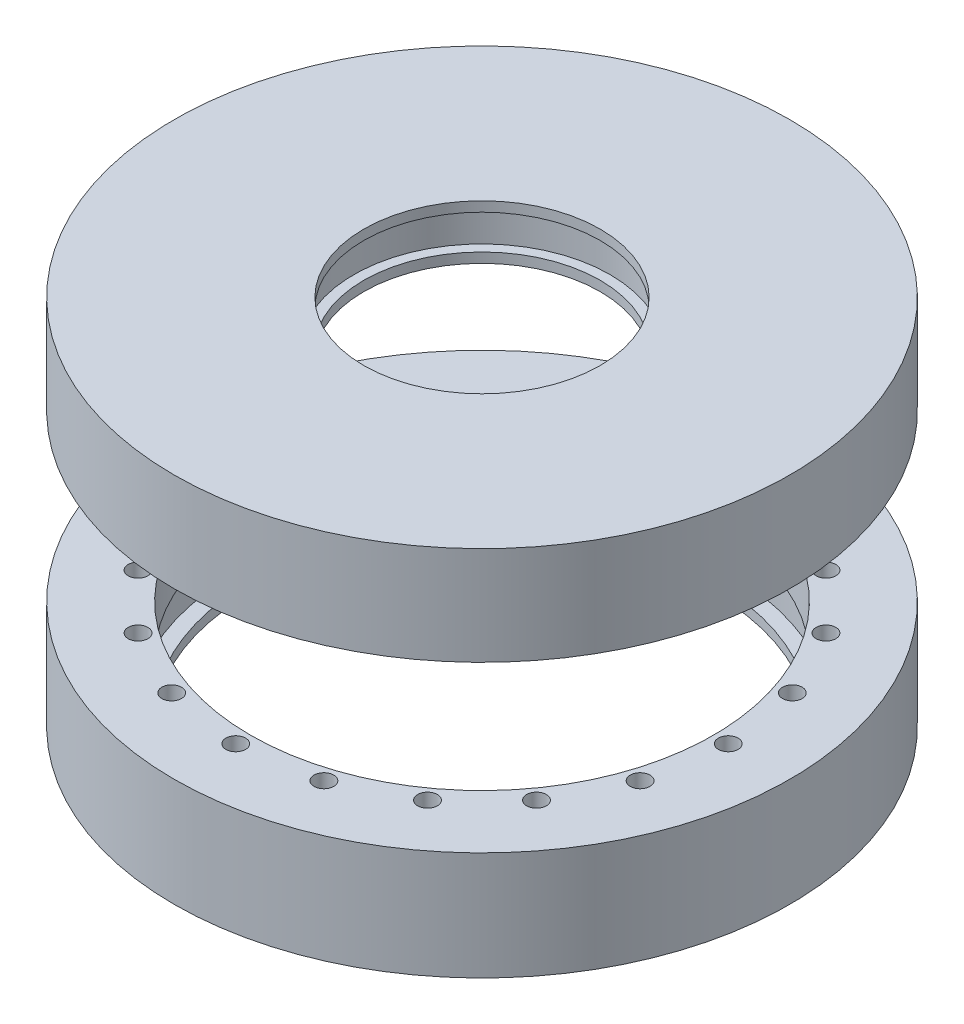
from build123d import *

# Parameters (mm, degrees)
CUT_EXTRUDE5_START = -2.5
SKETCH3_R          = 2
CUT_EXTRUDE5_DEPTH = 50
CUT_EXTRUDE6_START = 33.5
SKETCH5_R          = 62.5
CUT_EXTRUDE6_DEPTH = 33.5


with BuildPart() as part:
    # Sketch2 → Revolve1 (revolve)
    with BuildSketch(Plane(origin=(0, 0, 0), x_dir=(0, 0, -1), z_dir=(1, 0, 0))):
        Polygon((47, -37.75), (62.5, -37.75), (62.5, 37.75), (24, 37.75), (24, 35.75), (26, 35.75), (26, 28.75), (24, 28.75), (24, 26.75), (42.5, 26.75), (42.5, 17.75), (53, 17.75), (53, -15.75), (47, -15.75), (47, -25.75), (50, -25.75), (50, -35.75), (47, -35.75), align=None)
    revolve(axis=Axis((0, -15.437269333, 0), (0, 1, 0)))

    # Sketch3 → Cut-Extrude5 (cut)
    with BuildSketch(Plane.XZ.offset(25.75).offset(CUT_EXTRUDE5_START)):
        with Locations(Location((-47.552825815, 15.450849719, 0), (0, 0, 270))):
            Circle(SKETCH3_R)
        with Locations(Location((-40.450849719, 29.389262615, 0), (0, 0, 270))):
            Circle(SKETCH3_R)
        with Locations(Location((-29.389262615, 40.450849719, 0), (0, 0, 270))):
            Circle(SKETCH3_R)
        with Locations(Location((-15.450849719, 47.552825815, 0), (0, 0, 270))):
            Circle(SKETCH3_R)
        with Locations(Location((0, 50, 0), (0, 0, 270))):
            Circle(SKETCH3_R)
        with Locations(Location((15.450849719, 47.552825815, 0), (0, 0, 270))):
            Circle(SKETCH3_R)
        with Locations(Location((29.389262615, 40.450849719, 0), (0, 0, 270))):
            Circle(SKETCH3_R)
        with Locations(Location((40.450849719, 29.389262615, 0), (0, 0, 270))):
            Circle(SKETCH3_R)
        with Locations(Location((47.552825815, 15.450849719, 0), (0, 0, 270))):
            Circle(SKETCH3_R)
        with Locations(Location((50, 0, 0), (0, 0, 270))):
            Circle(SKETCH3_R)
        with Locations(Location((47.552825815, -15.450849719, 0), (0, 0, 270))):
            Circle(SKETCH3_R)
        with Locations(Location((40.450849719, -29.389262615, 0), (0, 0, 270))):
            Circle(SKETCH3_R)
        with Locations(Location((29.389262615, -40.450849719, 0), (0, 0, 270))):
            Circle(SKETCH3_R)
        with Locations(Location((15.450849719, -47.552825815, 0), (0, 0, 270))):
            Circle(SKETCH3_R)
        with Locations(Location((0, -50, 0), (0, 0, 270))):
            Circle(SKETCH3_R)
        with Locations(Location((-15.450849719, -47.552825815, 0), (0, 0, 270))):
            Circle(SKETCH3_R)
        with Locations(Location((-29.389262615, -40.450849719, 0), (0, 0, 270))):
            Circle(SKETCH3_R)
        with Locations(Location((-40.450849719, -29.389262615, 0), (0, 0, 270))):
            Circle(SKETCH3_R)
        with Locations(Location((-47.552825815, -15.450849719, 0), (0, 0, 270))):
            Circle(SKETCH3_R)
        with Locations(Location((-50, 0, 0), (0, 0, 270))):
            Circle(SKETCH3_R)
    extrude(amount=-CUT_EXTRUDE5_DEPTH, mode=Mode.SUBTRACT)

    # Sketch5 → Cut-Extrude6 (cut)
    with BuildSketch(Plane(origin=(0, -15.75, 0), x_dir=(1, 0, 0), z_dir=(0, 1, 0)).offset(CUT_EXTRUDE6_START)):
        with Locations(Location((0, 0, 0), (0, 0, 90))):
            Circle(SKETCH5_R)
    extrude(amount=-CUT_EXTRUDE6_DEPTH, mode=Mode.SUBTRACT)


with BuildPart() as cut_extrude6_piece_1:
    # of the separate pieces the step leaves, piece 1, a body of its own (cut_extrude6_pieces)
    add(part.part.solids().sort_by_distance((0, 17.75, -62.5))[0])


with BuildPart() as cut_extrude6_piece_2:
    # of the separate pieces the step leaves, piece 2, a body of its own (cut_extrude6_pieces)
    add(part.part.solids().sort_by_distance((0, -37.75, -47))[0])


solid = Compound([cut_extrude6_piece_1.part, cut_extrude6_piece_2.part])
